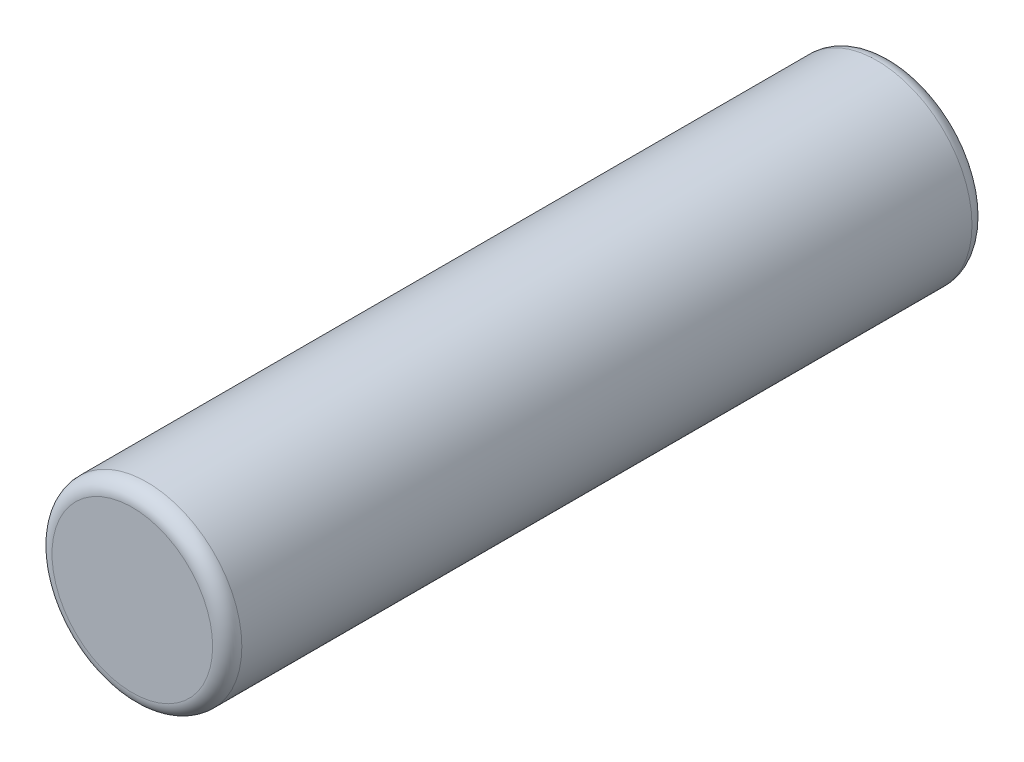
from build123d import *

# Parameters (mm, degrees)
SKETCH1_R           = 1.625
BOSS_EXTRUDE1_DEPTH = 6.5
FILLET1_R           = 0.25


with BuildPart() as part:
    # Sketch1 → Boss-Extrude1 (new, symmetric)
    with BuildSketch(Plane.XY):
        with Locations(Location((0, 0, 0), (0, 0, 180))):
            Circle(SKETCH1_R)
    extrude(amount=BOSS_EXTRUDE1_DEPTH, both=True)

    # Fillet1
    fillet1_edges = [part.edges().sort_by_distance(p)[0] for p in [
        (1.625, 0, -6.5),
        (1.625, 0, 6.5),
    ]]
    fillet(fillet1_edges, radius=FILLET1_R)


solid = part.part
